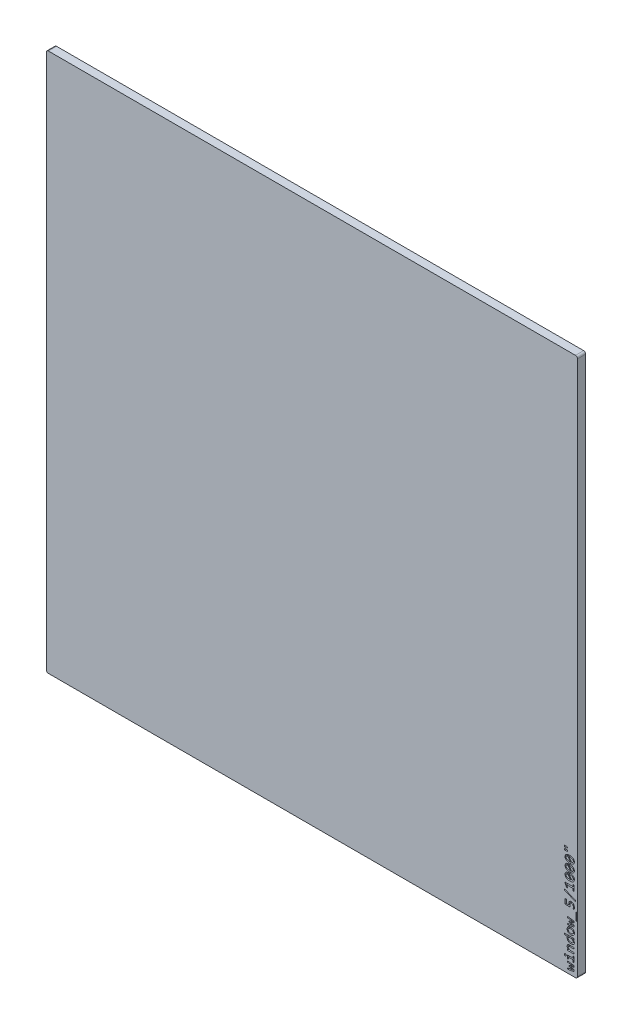
from build123d import *

# Parameters (mm, degrees)
SKETCH1_W           = 206.248
SKETCH1_H           = 209.296
BOSS_EXTRUDE1_DEPTH = 3.175
FILLET1_R           = 0.79375
SKETCH2_W           = 0.405797101
SKETCH2_H           = 2.992753623
CUT_EXTRUDE1_DEPTH  = 1.27


with BuildPart() as part:
    # Sketch1 → Boss-Extrude1 (new body)
    with BuildSketch(Plane.XY):
        with Locations((103.1875, 104.775)):
            Rectangle(SKETCH1_W, SKETCH1_H)
    extrude(amount=BOSS_EXTRUDE1_DEPTH)

    # Fillet1
    fillet1_edges = [part.edges().sort_by_distance(p)[0] for p in [
        (206.3115, 0.127, 1.5875),
        (0.0635, 0.127, 1.5875),
        (0.0635, 209.423, 1.5875),
        (206.3115, 209.423, 1.5875),
    ]]
    fillet(fillet1_edges, radius=FILLET1_R)

    # Sketch2 → Cut-Extrude1 (cut)
    # profile 1 of 16: a face of its own
    with BuildSketch(Plane.XY.offset(3.175)):
        Polygon((202.353094203, 4.313666667), (205.0415, 3.92213587), (205.0415, 3.357824275), (203.891477355, 2.971048913), (203.611699275, 2.893376812), (203.907328804, 2.806986413), (205.0415, 2.44240308), (205.0415, 1.893942935), (202.353094203, 1.473086957), (202.353094203, 1.928023551), (204.200580616, 2.185609601), (204.584185688, 2.233956522), (204.251305254, 2.348879529), (203.012514493, 2.730106884), (203.012514493, 3.064572464), (204.235453804, 3.483843297), (204.567541667, 3.603521739), (204.214054348, 3.643942935), (202.353094203, 3.853182065), align=None)
    # profile 2 of 16: a face of its own
    with BuildSketch(Plane.XY.offset(3.175)):
        Polygon((202.758891304, 5.708594203), (202.758891304, 4.947724638), (202.353094203, 4.947724638), (202.353094203, 6.21584058), (204.635702899, 6.21584058), (204.635702899, 6.976710145), (205.0415, 6.976710145), (205.0415, 4.846275362), (204.635702899, 4.846275362), (204.635702899, 5.708594203), align=None)
    # profile 3 of 16: a face of its own
    with BuildSketch(Plane.XY.offset(3.175)):
        with BuildLine():
            add(Edge.make_bspline(
                [(201.237152174, 5.886130435), (201.23859631, 5.912142324), (201.241425286, 5.963098059), (201.261490185, 6.036343339), (201.295039121, 6.101445903), (201.339230396, 6.157918915), (201.392551718, 6.203782618), (201.452830797, 6.239501129), (201.520301029, 6.262924399), (201.567993938, 6.265338644), (201.592224638, 6.266565217)],
                knots=[0, 0, 0, 0, 1.07923755, 2.114161841, 3.124507362, 4.100770453, 5.072588665, 6.026168051, 6.997181548, 8, 8, 8, 8], degree=3))
            add(Edge.make_bspline(
                [(201.592224638, 6.266565217), (201.615933562, 6.265312013), (201.663110191, 6.262818353), (201.730304864, 6.239070015), (201.791701872, 6.204323209), (201.845105816, 6.157821353), (201.889640285, 6.101692153), (201.921739073, 6.035968779), (201.943339907, 5.963274429), (201.945960971, 5.912177794), (201.947297101, 5.886130435)],
                knots=[0, 0, 0, 0, 0.981587727, 1.953188558, 2.926337264, 3.898743298, 4.875596899, 5.881598577, 6.920109654, 8, 8, 8, 8], degree=3))
            add(Edge.make_bspline(
                [(201.947297101, 5.886130435), (201.945913541, 5.86010141), (201.943185912, 5.808786325), (201.922166029, 5.735827001), (201.88908896, 5.670415764), (201.845682971, 5.61362966), (201.791371879, 5.568041624), (201.730352816, 5.533140366), (201.663098068, 5.509455281), (201.615929507, 5.506953127), (201.592224638, 5.505695652)],
                knots=[0, 0, 0, 0, 1.07958562, 2.12835591, 3.124273915, 4.109501101, 5.074488498, 6.047362598, 7.01868926, 8, 8, 8, 8], degree=3))
            add(Edge.make_bspline(
                [(201.592224638, 5.505695652), (201.567998135, 5.506926653), (201.520313487, 5.509349612), (201.452783161, 5.532709489), (201.392876457, 5.56857595), (201.338652808, 5.613530985), (201.295593526, 5.670666522), (201.261064814, 5.73545096), (201.241577949, 5.808961318), (201.238642965, 5.860136559), (201.237152174, 5.886130435)],
                knots=[0, 0, 0, 0, 1.002525831, 1.973255986, 2.926557118, 3.890951901, 4.875574045, 5.875879439, 6.92107737, 8, 8, 8, 8], degree=3))
        make_face()
    # profile 4 of 16: a face of its own
    with BuildSketch(Plane.XY.offset(3.175)):
        with BuildLine():
            Line((202.353094203, 7.788304348), (202.353094203, 8.240070652))
            Line((202.353094203, 8.240070652), (202.786631341, 8.260677536))
            add(Edge.make_bspline(
                [(202.786631341, 8.260677536), (202.763978447, 8.279742474), (202.720012371, 8.316744832), (202.659266103, 8.374225928), (202.603322445, 8.42934119), (202.539184872, 8.500923132), (202.471131044, 8.589184084), (202.403438094, 8.695035532), (202.354939841, 8.802449642), (202.322994496, 8.91162277), (202.305432121, 9.023603054), (202.303396238, 9.099160126), (202.302369565, 9.137262681)],
                knots=[0, 0, 0, 0, 0.854410729, 1.658290848, 2.413189534, 3.120566751, 4.430777517, 5.626275647, 6.738912042, 7.819923861, 8.900612878, 10, 10, 10, 10], degree=3))
            add(Edge.make_bspline(
                [(202.302369565, 9.137262681), (202.303158223, 9.170580514), (202.304690061, 9.235294893), (202.315719922, 9.329264987), (202.334597695, 9.416936043), (202.361468049, 9.498387217), (202.396628573, 9.573222524), (202.438690533, 9.642211476), (202.489110226, 9.704228981), (202.546642133, 9.760325195), (202.612340952, 9.809966314), (202.686198492, 9.85214809), (202.767221056, 9.889243237), (202.855971886, 9.918954542), (202.952760005, 9.942180726), (203.057085256, 9.956948497), (203.16894025, 9.968155259), (203.246027341, 9.969017302), (203.285951993, 9.969463768)],
                knots=[0, 0, 0, 0, 1.084895162, 2.107229392, 3.075878915, 4.000906046, 4.893849023, 5.762973654, 6.625601345, 7.489558035, 8.374005326, 9.299232485, 10.254066813, 11.271611206, 12.342117155, 13.490741827, 14.700414596, 16, 16, 16, 16], degree=3))
            Line((203.285951993, 9.969463768), (205.0415, 9.969463768))
            Line((205.0415, 9.969463768), (205.0415, 9.462217391))
            Line((205.0415, 9.462217391), (203.326373188, 9.462217391))
            add(Edge.make_bspline(
                [(203.326373188, 9.462217391), (203.300999173, 9.462004384), (203.25177035, 9.461591123), (203.180608001, 9.455830274), (203.11446462, 9.44717587), (203.053135489, 9.4356543), (202.997031458, 9.419710788), (202.945773807, 9.401081063), (202.900303003, 9.377728236), (202.859562252, 9.351576661), (202.823368208, 9.322072517), (202.792276145, 9.288826432), (202.766890362, 9.251588263), (202.744985602, 9.211739518), (202.728557643, 9.167918186), (202.716703959, 9.120868535), (202.709400145, 9.070385593), (202.708586937, 9.03557468), (202.708166667, 9.017584239)],
                knots=[0, 0, 0, 0, 1.402829076, 2.721667091, 3.944869442, 5.09095765, 6.168609952, 7.167208006, 8.101539423, 8.989006971, 9.840135635, 10.677485559, 11.496146598, 12.326328613, 13.186437782, 14.075827298, 15.005578631, 16, 16, 16, 16], degree=3))
            add(Edge.make_bspline(
                [(202.708166667, 9.017584239), (202.709408011, 8.990537789), (202.711885293, 8.936562705), (202.7316268, 8.855758865), (202.768351226, 8.775140773), (202.822760944, 8.691330287), (202.899783744, 8.604388634), (202.976442861, 8.527437501), (203.050849029, 8.46355802), (203.113711455, 8.409537166), (203.183894326, 8.353159495), (203.233300998, 8.315265075), (203.259004529, 8.295550725)],
                knots=[0, 0, 0, 0, 0.861448011, 1.719143497, 2.631313462, 3.672944429, 4.89121589, 6.326054317, 7.131579175, 8.015608799, 8.967632108, 10, 10, 10, 10], degree=3))
            Line((203.259004529, 8.295550725), (205.0415, 8.295550725))
            Line((205.0415, 8.295550725), (205.0415, 7.788304348))
            Line((205.0415, 7.788304348), (202.353094203, 7.788304348))
        make_face()
    # profile 5 of 16: a face of its own
    with BuildSketch(Plane.XY.offset(3.175)):
        with BuildLine():
            add(Edge.make_bspline(
                [(203.745644022, 10.679608696), (203.689842731, 10.680473668), (203.580829894, 10.68216347), (203.422386534, 10.701113973), (203.27297172, 10.729970802), (203.133331026, 10.771051349), (203.003938473, 10.823407647), (202.884577365, 10.885557248), (202.775821185, 10.9576762), (202.677176089, 11.039597882), (202.591169879, 11.132389205), (202.51373899, 11.232365892), (202.450146725, 11.342816993), (202.395597244, 11.46029003), (202.353725366, 11.586364206), (202.323757699, 11.719350799), (202.306190251, 11.859545982), (202.303663616, 11.955072225), (202.302369565, 12.003997283)],
                knots=[0, 0, 0, 0, 1.207916112, 2.359772676, 3.450449205, 4.500478701, 5.506646262, 6.468908734, 7.40992925, 8.327845072, 9.238582223, 10.144905422, 11.060446527, 11.992343093, 12.945856611, 13.931363337, 14.940519746, 16, 16, 16, 16], degree=3))
            add(Edge.make_bspline(
                [(202.302369565, 12.003997283), (202.303136418, 12.046822859), (202.304658905, 12.13184748), (202.31675599, 12.258753204), (202.337651344, 12.383629781), (202.359080032, 12.465149436), (202.369738225, 12.505695652)],
                knots=[0, 0, 0, 0, 1.011887207, 2.008970668, 3.009702567, 4, 4, 4, 4], degree=3))
            Line((202.369738225, 12.505695652), (201.237152174, 12.505695652))
            Line((201.237152174, 12.505695652), (201.237152174, 13.012942029))
            Line((201.237152174, 13.012942029), (205.0415, 13.012942029))
            Line((205.0415, 13.012942029), (205.0415, 12.560383152))
            Line((205.0415, 12.560383152), (204.531083333, 12.544531703))
            add(Edge.make_bspline(
                [(204.531083333, 12.544531703), (204.576415126, 12.511847166), (204.663794426, 12.448846084), (204.779608827, 12.343323018), (204.876963569, 12.2340844), (204.956038045, 12.120268918), (205.016816286, 12.001836642), (205.061047051, 11.879208162), (205.087155977, 11.751209641), (205.090520828, 11.664365948), (205.092224638, 11.62039221)],
                knots=[0, 0, 0, 0, 1.188754675, 2.291384117, 3.327160943, 4.297362325, 5.232919004, 6.152470134, 7.064494021, 8, 8, 8, 8], degree=3))
            add(Edge.make_bspline(
                [(205.092224638, 11.62039221), (205.091046868, 11.582528235), (205.088759167, 11.508981211), (205.069831416, 11.402303437), (205.040269988, 11.30229252), (204.996610399, 11.210114508), (204.943606962, 11.124580072), (204.879061918, 11.04707081), (204.805327579, 10.976385891), (204.721470984, 10.913377078), (204.627828891, 10.859134093), (204.526152104, 10.810152224), (204.414642566, 10.770299281), (204.294866065, 10.737188787), (204.167511547, 10.711083786), (204.032960491, 10.693262933), (203.891672163, 10.681907017), (203.79507019, 10.680386609), (203.745644022, 10.679608696)],
                knots=[0, 0, 0, 0, 0.982337542, 1.908093467, 2.804180496, 3.681781315, 4.547671991, 5.410051346, 6.292942989, 7.194186229, 8.125818099, 9.098337313, 10.120293836, 11.195284112, 12.322503484, 13.492320711, 14.716951878, 16, 16, 16, 16], degree=3))
        make_face()
        with BuildLine():
            add(Edge.make_bspline(
                [(203.72265942, 11.186855072), (203.761767467, 11.187359262), (203.837658596, 11.188337667), (203.947702247, 11.194487569), (204.050124666, 11.205349458), (204.144568862, 11.221194347), (204.231394105, 11.240986273), (204.310845317, 11.264325023), (204.382654381, 11.292693568), (204.44641617, 11.326311827), (204.503149538, 11.363237502), (204.55175448, 11.404904855), (204.593650103, 11.449542073), (204.628169483, 11.498152575), (204.654490677, 11.550870095), (204.672742177, 11.607270525), (204.684086718, 11.666965561), (204.685637743, 11.708052746), (204.686427536, 11.728974638)],
                knots=[0, 0, 0, 0, 1.517784893, 2.945337788, 4.275766664, 5.513009385, 6.65962676, 7.730091965, 8.723964778, 9.650390926, 10.523419201, 11.345275471, 12.128823694, 12.894044736, 13.650630645, 14.406104131, 15.188376708, 16, 16, 16, 16], degree=3))
            add(Edge.make_bspline(
                [(204.686427536, 11.728974638), (204.684631397, 11.758820895), (204.680919119, 11.820507433), (204.647388696, 11.912336418), (204.597862834, 12.006602257), (204.527390207, 12.102447728), (204.438670056, 12.200790644), (204.330548658, 12.301432652), (204.204034092, 12.404992271), (204.110662162, 12.471138083), (204.061880435, 12.505695652)],
                knots=[0, 0, 0, 0, 0.693218294, 1.43275039, 2.253088152, 3.170253651, 4.194465501, 5.335140929, 6.607756864, 8, 8, 8, 8], degree=3))
            Line((204.061880435, 12.505695652), (202.817541667, 12.505695652))
            add(Edge.make_bspline(
                [(202.817541667, 12.505695652), (202.800995881, 12.466137432), (202.766922985, 12.38467481), (202.733644959, 12.254290858), (202.712591153, 12.11907444), (202.709633735, 12.02785066), (202.708166667, 11.982597826)],
                knots=[0, 0, 0, 0, 0.954978635, 1.966596669, 2.991301802, 4, 4, 4, 4], degree=3))
            add(Edge.make_bspline(
                [(202.708166667, 11.982597826), (202.708993997, 11.952190111), (202.710611187, 11.892751839), (202.721282393, 11.806004445), (202.741589043, 11.724654339), (202.768338471, 11.648324595), (202.80244441, 11.577050999), (202.845012468, 11.511454537), (202.895371774, 11.450911231), (202.95324099, 11.395146019), (203.019806134, 11.345675393), (203.094718279, 11.302594017), (203.178898022, 11.267421839), (203.270716856, 11.237148507), (203.371546422, 11.214135072), (203.480849856, 11.199272122), (203.598793992, 11.188169093), (203.680359576, 11.187303808), (203.72265942, 11.186855072)],
                knots=[0, 0, 0, 0, 0.99345784, 1.941922242, 2.848300691, 3.727268067, 4.58034615, 5.423013755, 6.274999688, 7.14788682, 8.042019703, 8.977635172, 9.963566708, 11.017066942, 12.132955112, 13.336422451, 14.618670905, 16, 16, 16, 16], degree=3))
        make_face(mode=Mode.SUBTRACT)
    # profile 6 of 16: a face of its own
    with BuildSketch(Plane.XY.offset(3.175)):
        with BuildLine():
            add(Edge.make_bspline(
                [(203.675897645, 16.157869565), (203.727197092, 16.15684253), (203.827960842, 16.154825199), (203.975612308, 16.137831931), (204.116706462, 16.110266726), (204.250595715, 16.071406998), (204.376925346, 16.022714944), (204.49398772, 15.962701656), (204.60224607, 15.89406622), (204.700429323, 15.81491548), (204.788605594, 15.726688954), (204.867151982, 15.629582912), (204.933671982, 15.522111795), (204.990946138, 15.406673783), (205.036327062, 15.282331561), (205.068610858, 15.149723827), (205.089015874, 15.009008795), (205.091138778, 14.912281759), (205.092224638, 14.862806159)],
                knots=[0, 0, 0, 0, 1.137682146, 2.234665757, 3.292064677, 4.323284341, 5.323444728, 6.290591528, 7.236753627, 8.16208614, 9.082058246, 9.999151167, 10.926004237, 11.880028938, 12.853388225, 13.855469823, 14.903079009, 16, 16, 16, 16], degree=3))
            add(Edge.make_bspline(
                [(205.092224638, 14.862806159), (205.091202399, 14.815467407), (205.089208349, 14.723125191), (205.072405675, 14.588259374), (205.043991782, 14.461108537), (205.004362802, 14.341883882), (204.954241108, 14.230652615), (204.89329322, 14.128088289), (204.820957836, 14.03465976), (204.739281635, 13.949045254), (204.645879026, 13.873881605), (204.542510043, 13.807523117), (204.428959076, 13.750307634), (204.304407583, 13.703928306), (204.170595228, 13.666533513), (204.026491963, 13.640783945), (203.873081706, 13.624800431), (203.767348427, 13.622709508), (203.713148551, 13.621637681)],
                knots=[0, 0, 0, 0, 1.077482312, 2.101810833, 3.088247346, 4.039279708, 4.957210705, 5.860841599, 6.748700475, 7.642023149, 8.548532111, 9.471180557, 10.434177725, 11.437361354, 12.492450218, 13.593169009, 14.76623572, 16, 16, 16, 16], degree=3))
            add(Edge.make_bspline(
                [(203.713148551, 13.621637681), (203.661848651, 13.622656397), (203.561346596, 13.624652172), (203.414218446, 13.6416663), (203.273925868, 13.669266918), (203.14101851, 13.707935559), (203.015850536, 13.75694523), (202.900025303, 13.816900873), (202.791986356, 13.884767205), (202.6942313, 13.963863437), (202.605653921, 14.052024961), (202.527793937, 14.150097439), (202.460176549, 14.256957785), (202.402593284, 14.372457444), (202.357407689, 14.496852083), (202.32622488, 14.629903054), (202.305510991, 14.770482993), (202.303432637, 14.867220256), (202.302369565, 14.916701087)],
                knots=[0, 0, 0, 0, 1.140165783, 2.23370814, 3.287654293, 4.315485483, 5.306894427, 6.270924538, 7.211041269, 8.138393845, 9.060374312, 9.984055593, 10.916064858, 11.866908198, 12.847911069, 13.850788169, 14.900684357, 16, 16, 16, 16], degree=3))
            add(Edge.make_bspline(
                [(202.302369565, 14.916701087), (202.303406794, 14.964035364), (202.305430083, 15.056368849), (202.321992773, 15.191040563), (202.351038536, 15.317643416), (202.38912701, 15.437421559), (202.440551165, 15.548207887), (202.5002911, 15.651703298), (202.572919207, 15.744560347), (202.65366251, 15.830450852), (202.746422322, 15.905870777), (202.849582274, 15.971717295), (202.962609668, 16.029440335), (203.086817901, 16.075372855), (203.220499214, 16.113238836), (203.364179008, 16.138472418), (203.517007392, 16.154784953), (203.621958144, 16.156822412), (203.675897645, 16.157869565)],
                knots=[0, 0, 0, 0, 1.079837612, 2.106405242, 3.089117945, 4.040340163, 4.968261396, 5.870792832, 6.760592503, 7.651698004, 8.555516875, 9.480182165, 10.439904144, 11.445280661, 12.496869516, 13.605924118, 14.769563276, 16, 16, 16, 16], degree=3))
        make_face()
        with BuildLine():
            add(Edge.make_bspline(
                [(203.695711957, 15.650623188), (203.655791567, 15.650149228), (203.578712704, 15.649234098), (203.466759827, 15.6383943), (203.362594985, 15.622326341), (203.265820852, 15.599300708), (203.177056436, 15.570001441), (203.095494437, 15.53544283), (203.022142301, 15.493806147), (202.956220288, 15.447135633), (202.897319023, 15.395135893), (202.846725483, 15.337161896), (202.803291614, 15.274014645), (202.768441668, 15.20543852), (202.741581047, 15.132475131), (202.722540617, 15.055115696), (202.710344088, 14.973889825), (202.708899383, 14.918066003), (202.708166667, 14.889753623)],
                knots=[0, 0, 0, 0, 1.356519224, 2.619186811, 3.819509988, 4.936913966, 5.996184945, 6.99377994, 7.942819649, 8.857324597, 9.735111911, 10.606953056, 11.466309403, 12.333838493, 13.214652511, 14.103305864, 15.038046444, 16, 16, 16, 16], degree=3))
            add(Edge.make_bspline(
                [(202.708166667, 14.889753623), (202.708832312, 14.857170827), (202.710123576, 14.793964538), (202.727144379, 14.70322884), (202.750698133, 14.618711149), (202.786981277, 14.542616098), (202.831419823, 14.473753826), (202.881843727, 14.410648021), (202.940705381, 14.355189884), (203.004709877, 14.304774203), (203.075845364, 14.262113102), (203.152259869, 14.225935445), (203.233648005, 14.19436006), (203.320416889, 14.170783007), (203.410824592, 14.151135252), (203.503988353, 14.139706226), (203.599069611, 14.129649279), (203.663186851, 14.129141594), (203.695711957, 14.128884058)],
                knots=[0, 0, 0, 0, 1.110637689, 2.154489307, 3.141878424, 4.098089287, 5.018763327, 5.935719245, 6.84787245, 7.773348928, 8.712219521, 9.67229302, 10.657166387, 11.687883328, 12.738569762, 13.812532751, 14.89035145, 16, 16, 16, 16], degree=3))
            add(Edge.make_bspline(
                [(203.695711957, 14.128884058), (203.735629384, 14.129386822), (203.813228818, 14.130364194), (203.925483305, 14.14090184), (204.030115041, 14.157372533), (204.127168925, 14.1802219), (204.216540354, 14.209331264), (204.298493987, 14.244232674), (204.371995464, 14.285637925), (204.438951164, 14.331413839), (204.496635481, 14.384474232), (204.548284567, 14.441277484), (204.590187027, 14.504838816), (204.625199893, 14.572585586), (204.653662989, 14.645151588), (204.671641309, 14.722908085), (204.684452342, 14.804792348), (204.685756808, 14.860902833), (204.686427536, 14.889753623)],
                knots=[0, 0, 0, 0, 1.353436926, 2.63107981, 3.819827699, 4.943407898, 6.008783481, 7.004111729, 7.958805456, 8.866070606, 9.747847192, 10.610990163, 11.463369748, 12.320960703, 13.194550705, 14.098580282, 15.02233135, 16, 16, 16, 16], degree=3))
            add(Edge.make_bspline(
                [(204.686427536, 14.889753623), (204.685644785, 14.922314526), (204.684127423, 14.985433765), (204.668707328, 15.07649975), (204.643842115, 15.16049502), (204.607224063, 15.236383074), (204.563454578, 15.305680602), (204.512669655, 15.368773055), (204.454190587, 15.424450113), (204.389365719, 15.473717119), (204.319042636, 15.517594924), (204.242288933, 15.553509117), (204.16095344, 15.585128422), (204.073948081, 15.608942965), (203.983389484, 15.627825411), (203.889701057, 15.641403762), (203.793606388, 15.64942044), (203.728486749, 15.650220512), (203.695711957, 15.650623188)],
                knots=[0, 0, 0, 0, 1.10814016, 2.148127254, 3.135881691, 4.081802165, 5.007999381, 5.922893309, 6.832995325, 7.750893548, 8.692352109, 9.650266659, 10.632925307, 11.66132444, 12.718455334, 13.782343566, 14.883850839, 16, 16, 16, 16], degree=3))
        make_face(mode=Mode.SUBTRACT)
    # profile 7 of 16: a face of its own
    with BuildSketch(Plane.XY.offset(3.175)):
        Polygon((202.353094203, 19.277434783), (205.0415, 18.885903986), (205.0415, 18.321592391), (203.891477355, 17.934817029), (203.611699275, 17.857144928), (203.907328804, 17.770754529), (205.0415, 17.406171196), (205.0415, 16.857711051), (202.353094203, 16.436855072), (202.353094203, 16.891791667), (204.200580616, 17.149377717), (204.584185688, 17.197724638), (204.251305254, 17.312647645), (203.012514493, 17.693875), (203.012514493, 18.02834058), (204.235453804, 18.447611413), (204.567541667, 18.567289855), (204.214054348, 18.607711051), (202.353094203, 18.816950181), align=None)
    # profile 8 of 16: a face of its own
    with BuildSketch(Plane.XY.offset(3.175)):
        with Locations((205.954543478, 20.849898551)):
            Rectangle(SKETCH2_W, SKETCH2_H)
    # profile 9 of 16: a face of its own
    with BuildSketch(Plane.XY.offset(3.175)):
        with BuildLine():
            add(Edge.make_bspline(
                [(203.912084239, 24.933231884), (203.954960448, 24.931820184), (204.03936929, 24.929041021), (204.163322631, 24.908244675), (204.281129725, 24.872326442), (204.392511278, 24.822650524), (204.497356584, 24.761693773), (204.594439644, 24.689092833), (204.683673912, 24.605932543), (204.765633975, 24.512886501), (204.839015401, 24.410023054), (204.90383181, 24.297667638), (204.959647953, 24.176573316), (205.007267753, 24.047288551), (205.044960004, 23.911283476), (205.073255926, 23.769396387), (205.088833873, 23.621876163), (205.091084382, 23.521694378), (205.092224638, 23.470935688)],
                knots=[0, 0, 0, 0, 0.981813715, 1.932861136, 2.868928663, 3.795461383, 4.720194145, 5.641197171, 6.566068515, 7.509325801, 8.476560476, 9.455311152, 10.475982774, 11.527037579, 12.60762161, 13.705368581, 14.837388603, 16, 16, 16, 16], degree=3))
            add(Edge.make_bspline(
                [(205.092224638, 23.470935688), (205.092205567, 23.443981468), (205.092166096, 23.388194324), (205.087282122, 23.302902336), (205.083117327, 23.214879008), (205.076516895, 23.126661557), (205.069370142, 23.039479507), (205.061962297, 22.955377305), (205.052505132, 22.876639958), (205.045041374, 22.826559216), (205.0415, 22.802797101)],
                knots=[0, 0, 0, 0, 0.964532366, 1.996292403, 3.056854456, 4.118596128, 5.162203732, 6.187792537, 7.140150864, 8, 8, 8, 8], degree=3))
            Line((205.0415, 22.802797101), (204.635702899, 22.802797101))
            add(Edge.make_bspline(
                [(204.635702899, 22.802797101), (204.644083244, 22.853962024), (204.661897628, 22.96272503), (204.67452168, 23.134733145), (204.684727802, 23.317581139), (204.685859578, 23.44238576), (204.686427536, 23.505016304)],
                knots=[0, 0, 0, 0, 0.882277614, 1.875487332, 2.933858495, 4, 4, 4, 4], degree=3))
            add(Edge.make_bspline(
                [(204.686427536, 23.505016304), (204.685811769, 23.539642203), (204.684606011, 23.607444519), (204.675419407, 23.706367346), (204.658242706, 23.799703649), (204.636533916, 23.887869231), (204.608175928, 23.970129241), (204.57370256, 24.046137325), (204.534482039, 24.116052977), (204.488844748, 24.179173581), (204.438172108, 24.235612441), (204.382016616, 24.285256552), (204.321138081, 24.328289549), (204.254639785, 24.363257201), (204.183863729, 24.390874973), (204.10912015, 24.411868254), (204.029769645, 24.42380039), (203.975529362, 24.425245426), (203.94775, 24.425985507)],
                knots=[0, 0, 0, 0, 1.249357505, 2.446415382, 3.579556902, 4.670825315, 5.719935258, 6.713984129, 7.678807594, 8.60744501, 9.518647472, 10.410038271, 11.306562416, 12.202072394, 13.113723516, 14.043436707, 14.997938882, 16, 16, 16, 16], degree=3))
            add(Edge.make_bspline(
                [(203.94775, 24.425985507), (203.92104408, 24.425111961), (203.869538845, 24.423427234), (203.794569076, 24.413660193), (203.725925385, 24.394221274), (203.661929079, 24.368979619), (203.60433352, 24.335472503), (203.551321828, 24.295473579), (203.505873288, 24.246497512), (203.464744717, 24.191430036), (203.430467562, 24.128774315), (203.399013986, 24.060754139), (203.374373584, 23.985516492), (203.352428086, 23.904734173), (203.337275083, 23.816833699), (203.325309896, 23.722980282), (203.318117269, 23.622427647), (203.31728983, 23.553374822), (203.316862319, 23.517697464)],
                knots=[0, 0, 0, 0, 1.018488896, 1.964265249, 2.873233991, 3.731696263, 4.579935552, 5.405877547, 6.253638348, 7.117812577, 8.019779452, 8.970850119, 9.970946514, 11.033643647, 12.159695554, 13.367713629, 14.639982867, 16, 16, 16, 16], degree=3))
            Line((203.316862319, 23.517697464), (203.316862319, 22.853521739))
            Line((203.316862319, 22.853521739), (201.5415, 22.853521739))
            Line((201.5415, 22.853521739), (201.5415, 24.730333333))
            Line((201.5415, 24.730333333), (201.947297101, 24.730333333))
            Line((201.947297101, 24.730333333), (201.947297101, 23.310043478))
            Line((201.947297101, 23.310043478), (202.911065217, 23.310043478))
            Line((202.911065217, 23.310043478), (202.911065217, 23.613598732))
            add(Edge.make_bspline(
                [(202.911065217, 23.613598732), (202.91171739, 23.655092332), (202.913010694, 23.737377119), (202.922078067, 23.86008821), (202.936227801, 23.980959687), (202.955676075, 24.099643219), (202.981872101, 24.214790672), (203.018326808, 24.323733118), (203.063195528, 24.426356811), (203.115820557, 24.522549088), (203.178713144, 24.610974892), (203.25109506, 24.690838182), (203.333817791, 24.761173693), (203.426183099, 24.822662621), (203.530001311, 24.873872809), (203.647266592, 24.907573906), (203.77572084, 24.929663151), (203.865485568, 24.932012362), (203.912084239, 24.933231884)],
                knots=[0, 0, 0, 0, 1.059111627, 2.100294401, 3.13920337, 4.164718439, 5.169083825, 6.150061237, 7.092256861, 8.024992693, 8.943776981, 9.855580262, 10.769177353, 11.708109219, 12.6823179, 13.710645123, 14.811549967, 16, 16, 16, 16], degree=3))
        make_face()
    # profile 10 of 16: a face of its own
    with BuildSketch(Plane.XY.offset(3.175)):
        Polygon((201.237152174, 27.91409692), (205.599471014, 26.087217391), (205.599471014, 25.643376812), (201.237152174, 27.469463768), align=None)
    # profile 11 of 16: a face of its own
    with BuildSketch(Plane.XY.offset(3.175)):
        Polygon((205.0415, 31.020188406), (205.0415, 28.788304348), (204.584978261, 28.788304348), (204.584978261, 29.701347826), (201.998021739, 29.701347826), (202.505268116, 28.858843297), (202.099471014, 28.686855072), (201.5415, 29.805967391), (201.5415, 30.259318841), (204.584978261, 30.259318841), (204.584978261, 31.020188406), align=None)
    # profile 12 of 16: a face of its own
    with BuildSketch(Plane.XY.offset(3.175)):
        with BuildLine():
            add(Edge.make_bspline(
                [(203.293085145, 34.165115942), (203.358641949, 34.164392882), (203.48705208, 34.162976581), (203.674886914, 34.146334132), (203.854167481, 34.121469175), (204.024227578, 34.085974623), (204.184449649, 34.040879815), (204.332779435, 33.983272672), (204.469711825, 33.916167928), (204.594847549, 33.83817422), (204.707796636, 33.750546799), (204.807366401, 33.651856626), (204.893252307, 33.543093295), (204.965097467, 33.423830256), (205.023164731, 33.294578977), (205.0628044, 33.153832948), (205.088307077, 33.002810837), (205.09089319, 32.898430106), (205.092224638, 32.844690217)],
                knots=[0, 0, 0, 0, 1.248914837, 2.446326075, 3.590481536, 4.696348128, 5.754402402, 6.75852437, 7.724421974, 8.656180523, 9.563573712, 10.442878815, 11.321145607, 12.197505634, 13.09001432, 14.012532693, 14.976762566, 16, 16, 16, 16], degree=3))
            add(Edge.make_bspline(
                [(205.092224638, 32.844690217), (205.091096904, 32.798122173), (205.088875634, 32.706398237), (205.06865272, 32.572161584), (205.035319176, 32.444301943), (204.988658289, 32.323333192), (204.927877985, 32.210022083), (204.853868219, 32.104201858), (204.764093703, 32.007961694), (204.660149125, 31.920485329), (204.542219839, 31.841410998), (204.408265769, 31.773469078), (204.259901893, 31.714445999), (204.096538105, 31.664101085), (203.917670095, 31.626196575), (203.723444737, 31.597434309), (203.513434746, 31.581177177), (203.368142755, 31.579187358), (203.293085145, 31.57815942)],
                knots=[0, 0, 0, 0, 0.897207117, 1.767206898, 2.609613273, 3.439942234, 4.26013671, 5.082431154, 5.922077733, 6.789300863, 7.696067918, 8.652660293, 9.678696715, 10.770847102, 11.943518379, 13.199542273, 14.55328803, 16, 16, 16, 16], degree=3))
            add(Edge.make_bspline(
                [(203.293085145, 31.57815942), (203.227541412, 31.579342189), (203.098921841, 31.581663192), (202.910377809, 31.596385984), (202.730417839, 31.622765872), (202.5597469, 31.658659405), (202.399243176, 31.70506059), (202.250412934, 31.762469285), (202.112741995, 31.828531475), (201.987220235, 31.905588829), (201.875173207, 31.993827053), (201.775626069, 32.092184297), (201.689520674, 32.201103522), (201.617912555, 32.321068463), (201.55997575, 32.45087056), (201.520276919, 32.59156538), (201.494724504, 32.741781654), (201.492115516, 32.845373387), (201.490775362, 32.898585145)],
                knots=[0, 0, 0, 0, 1.248104217, 2.449214024, 3.598202953, 4.70919646, 5.767851728, 6.775909071, 7.743382507, 8.671783955, 9.574534295, 10.453175878, 11.330779933, 12.210788604, 13.107223223, 14.029045466, 14.98758374, 16, 16, 16, 16], degree=3))
            add(Edge.make_bspline(
                [(201.490775362, 32.898585145), (201.491915239, 32.945149701), (201.494160426, 33.036866767), (201.514172125, 33.170899811), (201.548005628, 33.298247987), (201.593616048, 33.419431741), (201.65383415, 33.5332361), (201.729473539, 33.638372417), (201.819655615, 33.734278175), (201.923692029, 33.822325808), (202.042652833, 33.900844529), (202.176515556, 33.970004733), (202.325687783, 34.027816813), (202.488912059, 34.078227036), (202.667847964, 34.117434137), (202.862228554, 34.145635596), (203.072461257, 34.16218801), (203.217760195, 34.164116294), (203.293085145, 34.165115942)],
                knots=[0, 0, 0, 0, 0.896346146, 1.765511063, 2.602189145, 3.429893923, 4.253790403, 5.07409759, 5.916402664, 6.782793596, 7.692923658, 8.655452938, 9.67862181, 10.769724156, 11.942363255, 13.202215208, 14.54959023, 16, 16, 16, 16], degree=3))
        make_face()
        with BuildLine():
            add(Edge.make_bspline(
                [(203.320032609, 33.657869565), (203.289637515, 33.657681838), (203.228795674, 33.657306066), (203.138515876, 33.650655144), (203.049419829, 33.644892807), (202.990839263, 33.63926224), (202.961789855, 33.636470109)],
                knots=[0, 0, 0, 0, 1.015675155, 2.033076313, 3.024625862, 4, 4, 4, 4], degree=3))
            Line((202.961789855, 33.636470109), (204.077731884, 32.184477355))
            add(Edge.make_bspline(
                [(204.077731884, 32.184477355), (204.120849552, 32.198695915), (204.204965588, 32.226434171), (204.323025379, 32.281201204), (204.42875874, 32.346862815), (204.517733321, 32.427534395), (204.591499891, 32.518996304), (204.635764621, 32.606370025), (204.662332211, 32.681016972), (204.676705271, 32.741569406), (204.68425048, 32.80592758), (204.685691824, 32.849956411), (204.686427536, 32.872430254)],
                knots=[0, 0, 0, 0, 1.369635289, 2.671950929, 3.919768706, 5.11129131, 6.280858786, 7.4472405, 8.047561792, 8.670450387, 9.321351747, 10, 10, 10, 10], degree=3))
            add(Edge.make_bspline(
                [(204.686427536, 32.872430254), (204.685426066, 32.901583796), (204.683451684, 32.959059542), (204.665825951, 33.042868274), (204.639497733, 33.12313949), (204.599445487, 33.197976367), (204.550726585, 33.268915686), (204.489971417, 33.333466853), (204.419845524, 33.393456708), (204.338365864, 33.447099993), (204.246703561, 33.495390567), (204.144708119, 33.538349229), (204.031908735, 33.574472208), (203.908867193, 33.604015302), (203.776171947, 33.62898074), (203.633198776, 33.645920529), (203.480027117, 33.656383887), (203.374474005, 33.657364033), (203.320032609, 33.657869565)],
                knots=[0, 0, 0, 0, 0.796325084, 1.569942251, 2.333029826, 3.098882654, 3.882521751, 4.680058524, 5.515410668, 6.401078198, 7.341567221, 8.345255342, 9.423649988, 10.576641411, 11.803778376, 13.113902518, 14.511430187, 16, 16, 16, 16], degree=3))
        make_face(mode=Mode.SUBTRACT)
        with BuildLine():
            add(Edge.make_bspline(
                [(203.287537138, 32.085405797), (203.315805705, 32.085372836), (203.372344073, 32.085306911), (203.456640079, 32.085798389), (203.539686766, 32.088594561), (203.594278114, 32.093358837), (203.621210145, 32.095709239)],
                knots=[0, 0, 0, 0, 1.015676347, 2.03139705, 3.028811753, 4, 4, 4, 4], degree=3))
            Line((203.621210145, 32.095709239), (202.505268116, 33.548494565))
            add(Edge.make_bspline(
                [(202.505268116, 33.548494565), (202.461829418, 33.534694906), (202.377127624, 33.507786736), (202.259803065, 33.451970605), (202.154848851, 33.386222554), (202.065447082, 33.307694363), (201.992360079, 33.21656905), (201.947268528, 33.130719575), (201.920815587, 33.056944861), (201.90626456, 32.997769425), (201.898789819, 32.935234684), (201.897319061, 32.892525472), (201.896572464, 32.870845109)],
                knots=[0, 0, 0, 0, 1.387365905, 2.705246439, 3.946796776, 5.150076001, 6.312935, 7.486775076, 8.085107282, 8.69814929, 9.339144989, 10, 10, 10, 10], degree=3))
            add(Edge.make_bspline(
                [(201.896572464, 32.870845109), (201.897609073, 32.841704382), (201.899652731, 32.784253902), (201.916739811, 32.700421185), (201.944947131, 32.620761383), (201.983963231, 32.545203823), (202.033947906, 32.474083502), (202.096531817, 32.409844475), (202.167682472, 32.348933129), (202.251240233, 32.295279553), (202.344890608, 32.246938342), (202.449401439, 32.205250257), (202.563884485, 32.169014948), (202.688442424, 32.137881735), (202.823862417, 32.114623899), (202.969342566, 32.097303395), (203.125172137, 32.086914645), (203.232305076, 32.085919065), (203.287537138, 32.085405797)],
                knots=[0, 0, 0, 0, 0.786408516, 1.550391895, 2.299573207, 3.062222815, 3.840203597, 4.637572255, 5.478018783, 6.364565426, 7.31230447, 8.320551553, 9.399100972, 10.553297605, 11.784944095, 13.107086051, 14.508566985, 16, 16, 16, 16], degree=3))
        make_face(mode=Mode.SUBTRACT)
    # profile 13 of 16: a face of its own
    with BuildSketch(Plane.XY.offset(3.175)):
        with BuildLine():
            add(Edge.make_bspline(
                [(203.293085145, 37.157869565), (203.358641949, 37.157146506), (203.48705208, 37.155730204), (203.674886914, 37.139087755), (203.854167481, 37.114222799), (204.024227578, 37.078728246), (204.184449649, 37.033633439), (204.332779435, 36.976026295), (204.469711825, 36.908921551), (204.594847549, 36.830927843), (204.707796636, 36.743300422), (204.807366401, 36.644610249), (204.893252307, 36.535846918), (204.965097467, 36.416583879), (205.023164731, 36.2873326), (205.0628044, 36.146586571), (205.088307077, 35.99556446), (205.09089319, 35.891183729), (205.092224638, 35.837443841)],
                knots=[0, 0, 0, 0, 1.248914837, 2.446326075, 3.590481536, 4.696348128, 5.754402402, 6.75852437, 7.724421974, 8.656180523, 9.563573712, 10.442878815, 11.321145607, 12.197505634, 13.09001432, 14.012532693, 14.976762566, 16, 16, 16, 16], degree=3))
            add(Edge.make_bspline(
                [(205.092224638, 35.837443841), (205.091096904, 35.790875797), (205.088875634, 35.69915186), (205.06865272, 35.564915207), (205.035319176, 35.437055566), (204.988658289, 35.316086815), (204.927877985, 35.202775706), (204.853868219, 35.096955481), (204.764093703, 35.000715318), (204.660149125, 34.913238953), (204.542219839, 34.834164621), (204.408265769, 34.766222701), (204.259901893, 34.707199622), (204.096538105, 34.656854708), (203.917670095, 34.618950199), (203.723444737, 34.590187932), (203.513434746, 34.5739308), (203.368142755, 34.571940981), (203.293085145, 34.570913043)],
                knots=[0, 0, 0, 0, 0.897207117, 1.767206898, 2.609613273, 3.439942234, 4.26013671, 5.082431154, 5.922077733, 6.789300863, 7.696067918, 8.652660293, 9.678696715, 10.770847102, 11.943518379, 13.199542273, 14.55328803, 16, 16, 16, 16], degree=3))
            add(Edge.make_bspline(
                [(203.293085145, 34.570913043), (203.227541412, 34.572095812), (203.098921841, 34.574416815), (202.910377809, 34.589139608), (202.730417839, 34.615519495), (202.5597469, 34.651413028), (202.399243176, 34.697814213), (202.250412934, 34.755222908), (202.112741995, 34.821285098), (201.987220235, 34.898342453), (201.875173207, 34.986580676), (201.775626069, 35.08493792), (201.689520674, 35.193857145), (201.617912555, 35.313822086), (201.55997575, 35.443624183), (201.520276919, 35.584319003), (201.494724504, 35.734535277), (201.492115516, 35.83812701), (201.490775362, 35.891338768)],
                knots=[0, 0, 0, 0, 1.248104217, 2.449214024, 3.598202953, 4.70919646, 5.767851728, 6.775909071, 7.743382507, 8.671783955, 9.574534295, 10.453175878, 11.330779933, 12.210788604, 13.107223223, 14.029045466, 14.98758374, 16, 16, 16, 16], degree=3))
            add(Edge.make_bspline(
                [(201.490775362, 35.891338768), (201.491915239, 35.937903324), (201.494160426, 36.02962039), (201.514172125, 36.163653434), (201.548005628, 36.29100161), (201.593616048, 36.412185365), (201.65383415, 36.525989723), (201.729473539, 36.631126041), (201.819655615, 36.727031798), (201.923692029, 36.815079431), (202.042652833, 36.893598153), (202.176515556, 36.962758356), (202.325687783, 37.020570437), (202.488912059, 37.070980659), (202.667847964, 37.11018776), (202.862228554, 37.138389219), (203.072461257, 37.154941633), (203.217760195, 37.156869917), (203.293085145, 37.157869565)],
                knots=[0, 0, 0, 0, 0.896346146, 1.765511063, 2.602189145, 3.429893923, 4.253790403, 5.07409759, 5.916402664, 6.782793596, 7.692923658, 8.655452938, 9.67862181, 10.769724156, 11.942363255, 13.202215208, 14.54959023, 16, 16, 16, 16], degree=3))
        make_face()
        with BuildLine():
            add(Edge.make_bspline(
                [(203.320032609, 36.650623188), (203.289637515, 36.650435462), (203.228795674, 36.650059689), (203.138515876, 36.643408767), (203.049419829, 36.63764643), (202.990839263, 36.632015863), (202.961789855, 36.629223732)],
                knots=[0, 0, 0, 0, 1.015675155, 2.033076313, 3.024625862, 4, 4, 4, 4], degree=3))
            Line((202.961789855, 36.629223732), (204.077731884, 35.177230978))
            add(Edge.make_bspline(
                [(204.077731884, 35.177230978), (204.120849552, 35.191449538), (204.204965588, 35.219187794), (204.323025379, 35.273954827), (204.42875874, 35.339616438), (204.517733321, 35.420288018), (204.591499891, 35.511749927), (204.635764621, 35.599123648), (204.662332211, 35.673770596), (204.676705271, 35.734323029), (204.68425048, 35.798681203), (204.685691824, 35.842710034), (204.686427536, 35.865183877)],
                knots=[0, 0, 0, 0, 1.369635289, 2.671950929, 3.919768706, 5.11129131, 6.280858786, 7.4472405, 8.047561792, 8.670450387, 9.321351747, 10, 10, 10, 10], degree=3))
            add(Edge.make_bspline(
                [(204.686427536, 35.865183877), (204.685426066, 35.894337419), (204.683451684, 35.951813165), (204.665825951, 36.035621897), (204.639497733, 36.115893113), (204.599445487, 36.19072999), (204.550726585, 36.261669309), (204.489971417, 36.326220476), (204.419845524, 36.386210331), (204.338365864, 36.439853616), (204.246703561, 36.48814419), (204.144708119, 36.531102852), (204.031908735, 36.567225831), (203.908867193, 36.596768925), (203.776171947, 36.621734364), (203.633198776, 36.638674152), (203.480027117, 36.64913751), (203.374474005, 36.650117656), (203.320032609, 36.650623188)],
                knots=[0, 0, 0, 0, 0.796325084, 1.569942251, 2.333029826, 3.098882654, 3.882521751, 4.680058524, 5.515410668, 6.401078198, 7.341567221, 8.345255342, 9.423649988, 10.576641411, 11.803778376, 13.113902518, 14.511430187, 16, 16, 16, 16], degree=3))
        make_face(mode=Mode.SUBTRACT)
        with BuildLine():
            add(Edge.make_bspline(
                [(203.287537138, 35.07815942), (203.315805705, 35.078126459), (203.372344073, 35.078060535), (203.456640079, 35.078552013), (203.539686766, 35.081348184), (203.594278114, 35.08611246), (203.621210145, 35.088462862)],
                knots=[0, 0, 0, 0, 1.015676347, 2.03139705, 3.028811753, 4, 4, 4, 4], degree=3))
            Line((203.621210145, 35.088462862), (202.505268116, 36.541248188))
            add(Edge.make_bspline(
                [(202.505268116, 36.541248188), (202.461829418, 36.527448529), (202.377127624, 36.500540359), (202.259803065, 36.444724228), (202.154848851, 36.378976178), (202.065447082, 36.300447986), (201.992360079, 36.209322673), (201.947268528, 36.123473198), (201.920815587, 36.049698484), (201.90626456, 35.990523048), (201.898789819, 35.927988308), (201.897319061, 35.885279096), (201.896572464, 35.863598732)],
                knots=[0, 0, 0, 0, 1.387365905, 2.705246439, 3.946796776, 5.150076001, 6.312935, 7.486775076, 8.085107282, 8.69814929, 9.339144989, 10, 10, 10, 10], degree=3))
            add(Edge.make_bspline(
                [(201.896572464, 35.863598732), (201.897609073, 35.834458005), (201.899652731, 35.777007525), (201.916739811, 35.693174808), (201.944947131, 35.613515006), (201.983963231, 35.537957446), (202.033947906, 35.466837125), (202.096531817, 35.402598098), (202.167682472, 35.341686753), (202.251240233, 35.288033176), (202.344890608, 35.239691965), (202.449401439, 35.19800388), (202.563884485, 35.161768572), (202.688442424, 35.130635358), (202.823862417, 35.107377522), (202.969342566, 35.090057018), (203.125172137, 35.079668268), (203.232305076, 35.078672688), (203.287537138, 35.07815942)],
                knots=[0, 0, 0, 0, 0.786408516, 1.550391895, 2.299573207, 3.062222815, 3.840203597, 4.637572255, 5.478018783, 6.364565426, 7.31230447, 8.320551553, 9.399100972, 10.553297605, 11.784944095, 13.107086051, 14.508566985, 16, 16, 16, 16], degree=3))
        make_face(mode=Mode.SUBTRACT)
    # profile 14 of 16: a face of its own
    with BuildSketch(Plane.XY.offset(3.175)):
        with BuildLine():
            add(Edge.make_bspline(
                [(203.293085145, 40.150623188), (203.358641949, 40.149900129), (203.48705208, 40.148483827), (203.674886914, 40.131841379), (203.854167481, 40.106976422), (204.024227578, 40.071481869), (204.184449649, 40.026387062), (204.332779435, 39.968779918), (204.469711825, 39.901675174), (204.594847549, 39.823681466), (204.707796636, 39.736054045), (204.807366401, 39.637363872), (204.893252307, 39.528600541), (204.965097467, 39.409337502), (205.023164731, 39.280086223), (205.0628044, 39.139340194), (205.088307077, 38.988318083), (205.09089319, 38.883937352), (205.092224638, 38.830197464)],
                knots=[0, 0, 0, 0, 1.248914837, 2.446326075, 3.590481536, 4.696348128, 5.754402402, 6.75852437, 7.724421974, 8.656180523, 9.563573712, 10.442878815, 11.321145607, 12.197505634, 13.09001432, 14.012532693, 14.976762566, 16, 16, 16, 16], degree=3))
            add(Edge.make_bspline(
                [(205.092224638, 38.830197464), (205.091096904, 38.78362942), (205.088875634, 38.691905483), (205.06865272, 38.55766883), (205.035319176, 38.429809189), (204.988658289, 38.308840439), (204.927877985, 38.19552933), (204.853868219, 38.089709104), (204.764093703, 37.993468941), (204.660149125, 37.905992576), (204.542219839, 37.826918245), (204.408265769, 37.758976324), (204.259901893, 37.699953245), (204.096538105, 37.649608332), (203.917670095, 37.611703822), (203.723444737, 37.582941556), (203.513434746, 37.566684423), (203.368142755, 37.564694604), (203.293085145, 37.563666667)],
                knots=[0, 0, 0, 0, 0.897207117, 1.767206898, 2.609613273, 3.439942234, 4.26013671, 5.082431154, 5.922077733, 6.789300863, 7.696067918, 8.652660293, 9.678696715, 10.770847102, 11.943518379, 13.199542273, 14.55328803, 16, 16, 16, 16], degree=3))
            add(Edge.make_bspline(
                [(203.293085145, 37.563666667), (203.227541412, 37.564849435), (203.098921841, 37.567170439), (202.910377809, 37.581893231), (202.730417839, 37.608273118), (202.5597469, 37.644166651), (202.399243176, 37.690567836), (202.250412934, 37.747976531), (202.112741995, 37.814038721), (201.987220235, 37.891096076), (201.875173207, 37.979334299), (201.775626069, 38.077691543), (201.689520674, 38.186610768), (201.617912555, 38.30657571), (201.55997575, 38.436377806), (201.520276919, 38.577072626), (201.494724504, 38.7272889), (201.492115516, 38.830880634), (201.490775362, 38.884092391)],
                knots=[0, 0, 0, 0, 1.248104217, 2.449214024, 3.598202953, 4.70919646, 5.767851728, 6.775909071, 7.743382507, 8.671783955, 9.574534295, 10.453175878, 11.330779933, 12.210788604, 13.107223223, 14.029045466, 14.98758374, 16, 16, 16, 16], degree=3))
            add(Edge.make_bspline(
                [(201.490775362, 38.884092391), (201.491915239, 38.930656947), (201.494160426, 39.022374013), (201.514172125, 39.156407057), (201.548005628, 39.283755233), (201.593616048, 39.404938988), (201.65383415, 39.518743347), (201.729473539, 39.623879664), (201.819655615, 39.719785422), (201.923692029, 39.807833055), (202.042652833, 39.886351776), (202.176515556, 39.95551198), (202.325687783, 40.01332406), (202.488912059, 40.063734282), (202.667847964, 40.102941383), (202.862228554, 40.131142843), (203.072461257, 40.147695256), (203.217760195, 40.14962354), (203.293085145, 40.150623188)],
                knots=[0, 0, 0, 0, 0.896346146, 1.765511063, 2.602189145, 3.429893923, 4.253790403, 5.07409759, 5.916402664, 6.782793596, 7.692923658, 8.655452938, 9.67862181, 10.769724156, 11.942363255, 13.202215208, 14.54959023, 16, 16, 16, 16], degree=3))
        make_face()
        with BuildLine():
            add(Edge.make_bspline(
                [(203.320032609, 39.643376812), (203.289637515, 39.643189085), (203.228795674, 39.642813312), (203.138515876, 39.63616239), (203.049419829, 39.630400053), (202.990839263, 39.624769486), (202.961789855, 39.621977355)],
                knots=[0, 0, 0, 0, 1.015675155, 2.033076313, 3.024625862, 4, 4, 4, 4], degree=3))
            Line((202.961789855, 39.621977355), (204.077731884, 38.169984601))
            add(Edge.make_bspline(
                [(204.077731884, 38.169984601), (204.120849552, 38.184203161), (204.204965588, 38.211941417), (204.323025379, 38.26670845), (204.42875874, 38.332370061), (204.517733321, 38.413041642), (204.591499891, 38.50450355), (204.635764621, 38.591877271), (204.662332211, 38.666524219), (204.676705271, 38.727076652), (204.68425048, 38.791434827), (204.685691824, 38.835463657), (204.686427536, 38.8579375)],
                knots=[0, 0, 0, 0, 1.369635289, 2.671950929, 3.919768706, 5.11129131, 6.280858786, 7.4472405, 8.047561792, 8.670450387, 9.321351747, 10, 10, 10, 10], degree=3))
            add(Edge.make_bspline(
                [(204.686427536, 38.8579375), (204.685426066, 38.887091042), (204.683451684, 38.944566788), (204.665825951, 39.02837552), (204.639497733, 39.108646736), (204.599445487, 39.183483613), (204.550726585, 39.254422933), (204.489971417, 39.3189741), (204.419845524, 39.378963954), (204.338365864, 39.432607239), (204.246703561, 39.480897813), (204.144708119, 39.523856475), (204.031908735, 39.559979454), (203.908867193, 39.589522548), (203.776171947, 39.614487987), (203.633198776, 39.631427776), (203.480027117, 39.641891133), (203.374474005, 39.642871279), (203.320032609, 39.643376812)],
                knots=[0, 0, 0, 0, 0.796325084, 1.569942251, 2.333029826, 3.098882654, 3.882521751, 4.680058524, 5.515410668, 6.401078198, 7.341567221, 8.345255342, 9.423649988, 10.576641411, 11.803778376, 13.113902518, 14.511430187, 16, 16, 16, 16], degree=3))
        make_face(mode=Mode.SUBTRACT)
        with BuildLine():
            add(Edge.make_bspline(
                [(203.287537138, 38.070913043), (203.315805705, 38.070880082), (203.372344073, 38.070814158), (203.456640079, 38.071305636), (203.539686766, 38.074101807), (203.594278114, 38.078866083), (203.621210145, 38.081216486)],
                knots=[0, 0, 0, 0, 1.015676347, 2.03139705, 3.028811753, 4, 4, 4, 4], degree=3))
            Line((203.621210145, 38.081216486), (202.505268116, 39.534001812))
            add(Edge.make_bspline(
                [(202.505268116, 39.534001812), (202.461829418, 39.520202153), (202.377127624, 39.493293982), (202.259803065, 39.437477851), (202.154848851, 39.371729801), (202.065447082, 39.293201609), (201.992360079, 39.202076296), (201.947268528, 39.116226821), (201.920815587, 39.042452108), (201.90626456, 38.983276672), (201.898789819, 38.920741931), (201.897319061, 38.878032719), (201.896572464, 38.856352355)],
                knots=[0, 0, 0, 0, 1.387365905, 2.705246439, 3.946796776, 5.150076001, 6.312935, 7.486775076, 8.085107282, 8.69814929, 9.339144989, 10, 10, 10, 10], degree=3))
            add(Edge.make_bspline(
                [(201.896572464, 38.856352355), (201.897609073, 38.827211628), (201.899652731, 38.769761149), (201.916739811, 38.685928432), (201.944947131, 38.606268629), (201.983963231, 38.530711069), (202.033947906, 38.459590748), (202.096531817, 38.395351721), (202.167682472, 38.334440376), (202.251240233, 38.280786799), (202.344890608, 38.232445588), (202.449401439, 38.190757503), (202.563884485, 38.154522195), (202.688442424, 38.123388982), (202.823862417, 38.100131145), (202.969342566, 38.082810641), (203.125172137, 38.072421892), (203.232305076, 38.071426312), (203.287537138, 38.070913043)],
                knots=[0, 0, 0, 0, 0.786408516, 1.550391895, 2.299573207, 3.062222815, 3.840203597, 4.637572255, 5.478018783, 6.364565426, 7.31230447, 8.320551553, 9.399100972, 10.553297605, 11.784944095, 13.107086051, 14.508566985, 16, 16, 16, 16], degree=3))
        make_face(mode=Mode.SUBTRACT)
    # profile 15 of 16: a face of its own
    with BuildSketch(Plane.XY.offset(3.175)):
        Polygon((201.237152174, 41.570913043), (202.505268116, 41.494033514), (202.505268116, 41.04226721), (201.237152174, 40.962217391), align=None)
    # profile 16 of 16: a face of its own
    with BuildSketch(Plane.XY.offset(3.175)):
        Polygon((201.237152174, 42.636130435), (202.505268116, 42.559250906), (202.505268116, 42.107484601), (201.237152174, 42.027434783), align=None)
    extrude(amount=-CUT_EXTRUDE1_DEPTH, mode=Mode.SUBTRACT)


solid = part.part
